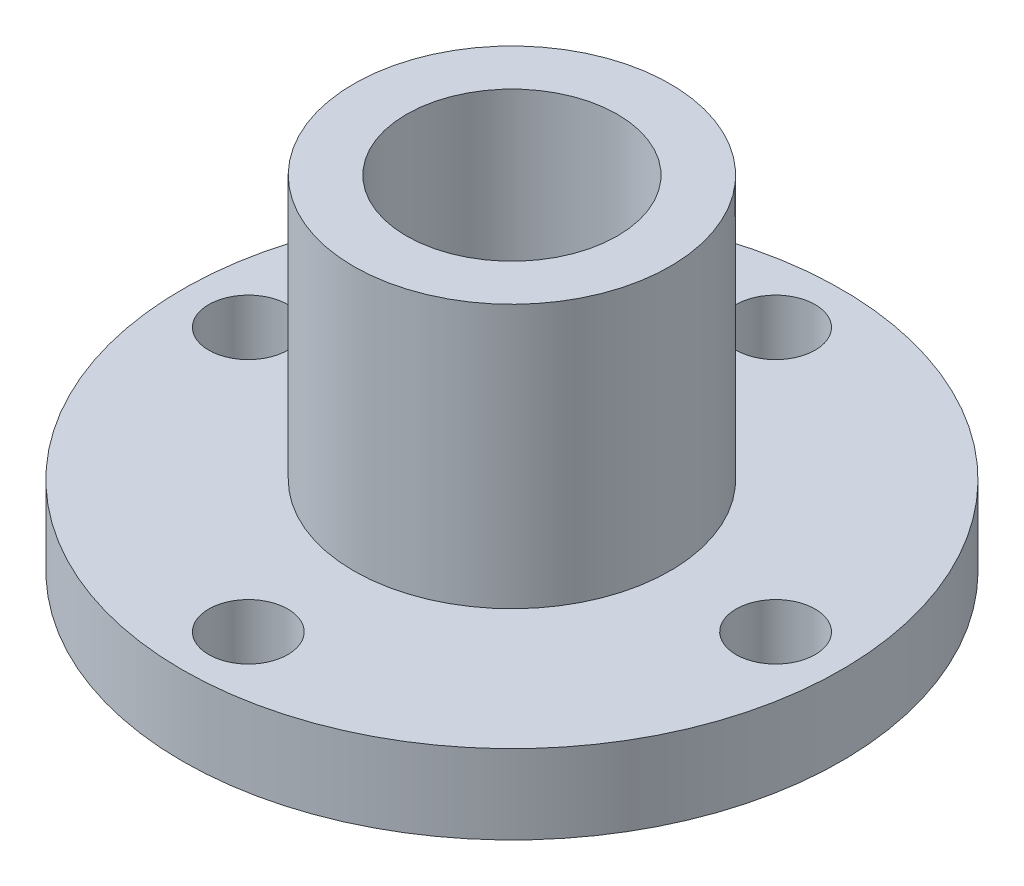
from build123d import *

# Parameters (mm, degrees)
SKETCH1_R           = 12.5
SKETCH1_R_2         = 1.5
SKETCH1_R_3         = 4
BOSS_EXTRUDE1_DEPTH = 3
BOSS_EXTRUDE2_START = 3
SKETCH1_3_R         = 6
SKETCH1_3_R_2       = 4
BOSS_EXTRUDE2_DEPTH = 10


with BuildPart() as part:
    # Sketch1 → Boss-Extrude1 (new body)
    with BuildSketch(Plane(origin=(0, 0, 0), x_dir=(1, 0, 0), z_dir=(0, 1, 0))):
        Circle(SKETCH1_R)
        with Locations((-10, 0)):
            Circle(SKETCH1_R_2, mode=Mode.SUBTRACT)
        with Locations((0, -10)):
            Circle(SKETCH1_R_2, mode=Mode.SUBTRACT)
        with Locations((10, 0)):
            Circle(SKETCH1_R_2, mode=Mode.SUBTRACT)
        with Locations((0, 10)):
            Circle(SKETCH1_R_2, mode=Mode.SUBTRACT)
        Circle(SKETCH1_R_3, mode=Mode.SUBTRACT)
    extrude(amount=BOSS_EXTRUDE1_DEPTH)

    # Sketch1<3> → Boss-Extrude2 (add)
    with BuildSketch(Plane(origin=(0, 0, 0), x_dir=(1, 0, 0), z_dir=(0, 1, 0)).offset(BOSS_EXTRUDE2_START)):
        Circle(SKETCH1_3_R)
        Circle(SKETCH1_3_R_2, mode=Mode.SUBTRACT)
    extrude(amount=BOSS_EXTRUDE2_DEPTH)


solid = part.part
